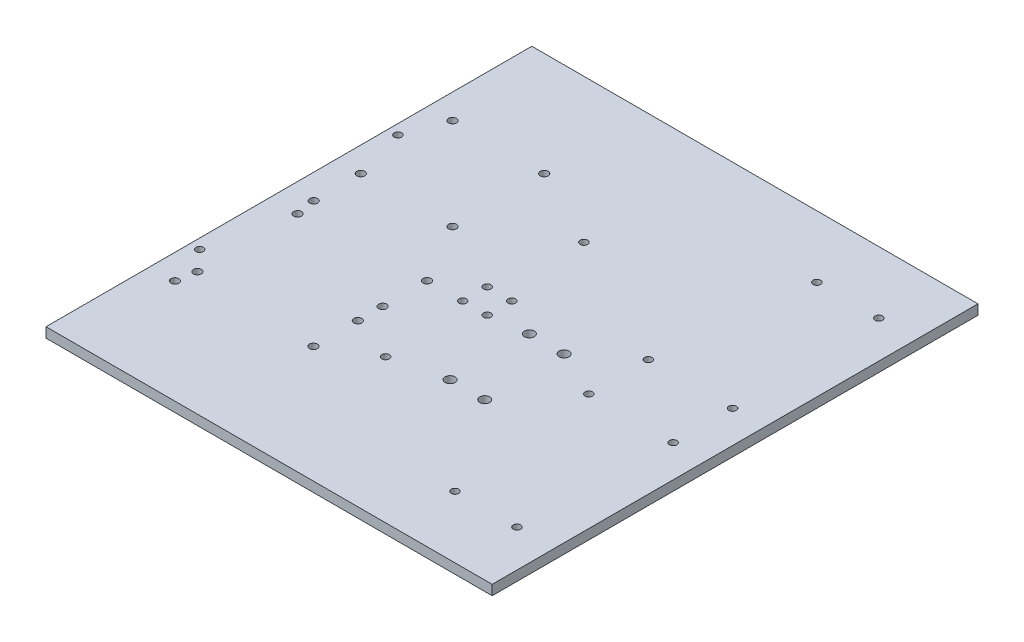
from build123d import *

# Parameters (mm, degrees)
SKETCH_1_W           = 180
SKETCH_1_H           = 160
EXTRUDE_1_DEPTH      = 4
SKETCH_4_R           = 1.6
CUT_EXTRUDE_3_DEPTH  = 4
SKETCH_5_R           = 1.6
CUT_EXTRUDE_4_DEPTH  = 4
SKETCH_7_R           = 2
CUT_EXTRUDE_5_DEPTH  = 10
SKETCH_8_R           = 1.5
CUT_EXTRUDE_6_DEPTH  = 10
SKETCH_11_R          = 1.5
CUT_EXTRUDE_8_DEPTH  = 4
SKETCH_12_R          = 1.5
CUT_EXTRUDE_9_DEPTH  = 4
SKETCH_13_W          = 180
SKETCH_13_H          = 4
EXTRUDE_2_DEPTH      = 18
SKETCH_15_R          = 1.5
CUT_EXTRUDE_10_DEPTH = 134.116490338


with BuildPart() as part:
    # 草图1 → 凸台-拉伸1 (new body)
    with BuildSketch(Plane(origin=(0, 0, 0), x_dir=(1, 0, 0), z_dir=(0, 1, 0))):
        Rectangle(SKETCH_1_W, SKETCH_1_H)
    extrude(amount=EXTRUDE_1_DEPTH)

    # 草图4 → 切除-拉伸3 (cut)
    with BuildSketch(Plane(origin=(0, 4, 0), x_dir=(1, 0, 0), z_dir=(0, 1, 0))):
        with Locations(Location((-80, 56, 0), (0, 0, 270))):
            Circle(SKETCH_4_R)
        with Locations(Location((-43, 56, 0), (0, 0, 270))):
            Circle(SKETCH_4_R)
        with Locations(Location((-43, 19, 0), (0, 0, 270))):
            Circle(SKETCH_4_R)
        with Locations(Location((-80, 19, 0), (0, 0, 270))):
            Circle(SKETCH_4_R)
    extrude(amount=-CUT_EXTRUDE_3_DEPTH, mode=Mode.SUBTRACT)

    # 草图5 → 切除-拉伸4 (cut)
    with BuildSketch(Plane(origin=(0, 4, 0), x_dir=(1, 0, 0), z_dir=(0, 1, 0))):
        with Locations(Location((-78.7, -7.8, 0), (0, 0, 270))):
            Circle(SKETCH_5_R)
        with Locations(Location((-29.2, -23, 0), (0, 0, 270))):
            Circle(SKETCH_5_R)
        with Locations(Location((-29.2, -50.9, 0), (0, 0, 270))):
            Circle(SKETCH_5_R)
        with Locations(Location((-80, -56, 0), (0, 0, 270))):
            Circle(SKETCH_5_R)
        with Locations(Location((-29.2, -5.1, 0), (0, 0, 90))):
            Circle(SKETCH_5_R)
        with Locations(Location((-29.2, -33, 0), (0, 0, 90))):
            Circle(SKETCH_5_R)
        with Locations(Location((-80, 0, 0), (0, 0, 90))):
            Circle(SKETCH_5_R)
        with Locations(Location((-78.7, -48.2, 0), (0, 0, 90))):
            Circle(SKETCH_5_R)
    extrude(amount=-CUT_EXTRUDE_4_DEPTH, mode=Mode.SUBTRACT)

    # 草图7 → 切除-拉伸5 (cut)
    with BuildSketch(Plane.XZ):
        with Locations(Location((24, 35, 0), (0, 0, 270))):
            Circle(SKETCH_7_R)
        with Locations(Location((10, 35, 0), (0, 0, 270))):
            Circle(SKETCH_7_R)
        with Locations(Location((24, 3, 0), (0, 0, 270))):
            Circle(SKETCH_7_R)
        with Locations(Location((10, 3, 0), (0, 0, 270))):
            Circle(SKETCH_7_R)
    extrude(amount=-CUT_EXTRUDE_5_DEPTH, mode=Mode.SUBTRACT)

    # 草图8 → 切除-拉伸6 (cut)
    with BuildSketch(Plane.XZ):
        with Locations(Location((-14.949747468, 4.949747468, 0), (0, 0, 270))):
            Circle(SKETCH_8_R)
        with Locations(Location((-5.050252532, 4.949747468, 0), (0, 0, 270))):
            Circle(SKETCH_8_R)
        with Locations(Location((-14.949747468, -4.949747468, 0), (0, 0, 270))):
            Circle(SKETCH_8_R)
        with Locations(Location((-5.050252532, -4.949747468, 0), (0, 0, 270))):
            Circle(SKETCH_8_R)
    extrude(amount=-CUT_EXTRUDE_6_DEPTH, mode=Mode.SUBTRACT)

    # 草图11 → 切除-拉伸8 (cut)
    with BuildSketch(Plane.XZ):
        with Locations(Location((77, 12, 0), (0, 0, 270))):
            Circle(SKETCH_11_R)
        with Locations(Location((43, 12, 0), (0, 0, 90))):
            Circle(SKETCH_11_R)
        with Locations(Location((77, -12, 0), (0, 0, 90))):
            Circle(SKETCH_11_R)
        with Locations(Location((43, -12, 0), (0, 0, 270))):
            Circle(SKETCH_11_R)
    extrude(amount=-CUT_EXTRUDE_8_DEPTH, mode=Mode.SUBTRACT)

    # 草图12 → 切除-拉伸9 (cut)
    with BuildSketch(Plane.XZ):
        with Locations(Location((-86, 40, 0), (0, 0, 270))):
            Circle(SKETCH_12_R)
        with Locations(Location((-11, 40, 0), (0, 0, 270))):
            Circle(SKETCH_12_R)
        with Locations(Location((-11, -40, 0), (0, 0, 270))):
            Circle(SKETCH_12_R)
        with Locations(Location((-86, -40, 0), (0, 0, 270))):
            Circle(SKETCH_12_R)
    extrude(amount=-CUT_EXTRUDE_9_DEPTH, mode=Mode.SUBTRACT)

    # 草图13 → 凸台-拉伸2 (add)
    with BuildSketch(Plane(origin=(0, 0, -80), x_dir=(-1, 0, 0), z_dir=(0, 0, -1))):
        with Locations((0, 2)):
            Rectangle(SKETCH_13_W, SKETCH_13_H)
    extrude_2 = extrude(amount=EXTRUDE_2_DEPTH)

    # 镜向1: 凸台-拉伸2 across plane
    add(extrude_2.mirror(Plane.XY))

    # 草图15 → 切除-拉伸10 (cut, through all)
    with BuildSketch(Plane(origin=(0, 4, 0), x_dir=(1, 0, 0), z_dir=(0, 1, 0))):
        with Locations(Location((75, -73, 0), (0, 0, 270))):
            Circle(SKETCH_15_R)
        with Locations(Location((50, -73, 0), (0, 0, 270))):
            Circle(SKETCH_15_R)
    cut_extrude_10 = extrude(amount=-CUT_EXTRUDE_10_DEPTH, mode=Mode.SUBTRACT)

    # 镜向2: 切除-拉伸10 across plane
    add(cut_extrude_10.mirror(Plane.XY), mode=Mode.SUBTRACT)


solid = part.part
